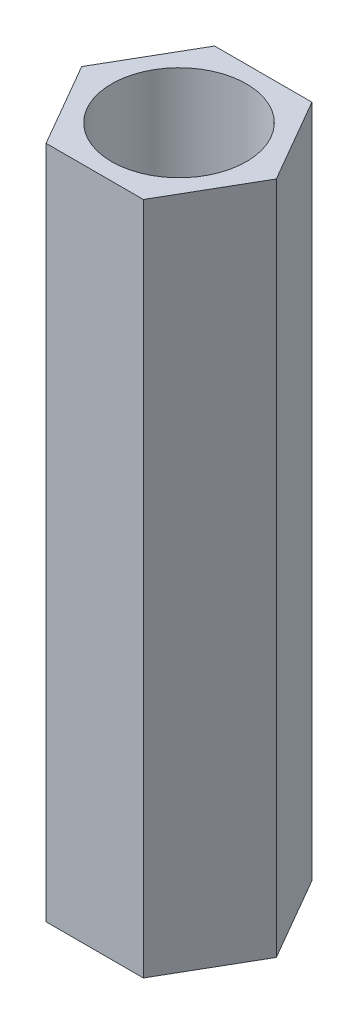
from build123d import *

# Parameters (mm, degrees)
SKETCH_1_R      = 2
EXTRUDE_1_DEPTH = 20


with BuildPart() as part:
    # 草图1 → 凸台-拉伸1 (new body)
    with BuildSketch(Plane(origin=(0, 0, 0), x_dir=(1, 0, 0), z_dir=(0, 1, 0))):
        Polygon((1.443375673, 2.5), (-1.443375673, 2.5), (-2.886751346, 0), (-1.443375673, -2.5), (1.443375673, -2.5), (2.886751346, 0), align=None)
        with Locations(Location((0, 0, 0), (0, 0, 270))):
            Circle(SKETCH_1_R, mode=Mode.SUBTRACT)
    extrude(amount=EXTRUDE_1_DEPTH)


solid = part.part
